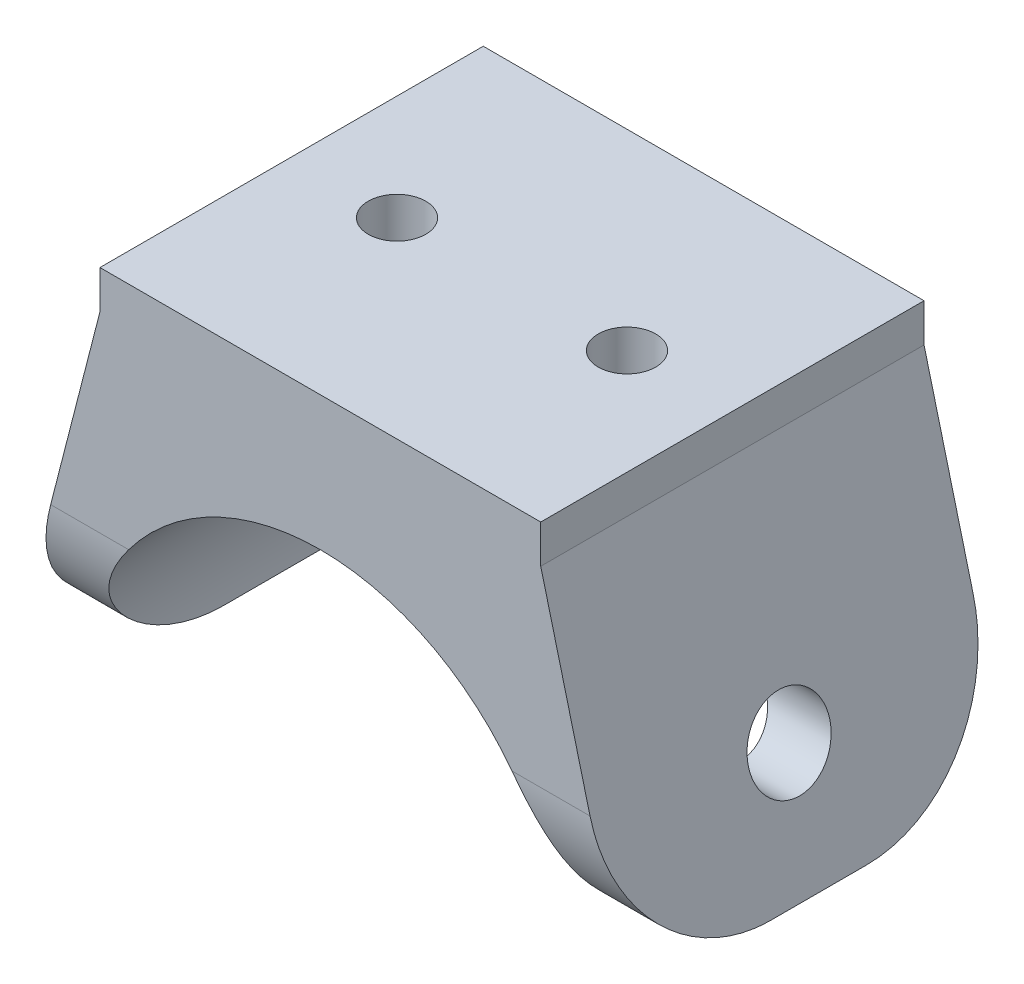
from build123d import *

# Parameters (mm, degrees)
BOSS_EXTRUDE1_DEPTH     = 20
CUT_EXTRUDE1_DEPTH      = 55.267854205
CUT_EXTRUDE1_DEPTH_BACK = 55.267854205
SKETCH3_R               = 4.25
SKETCH4_R               = 3
CUT_EXTRUDE2_DEPTH      = 14
FILLET1_R               = 15


with BuildPart() as part:
    # Sketch1 → Boss-Extrude1 (new, symmetric)
    with BuildSketch(Plane.XY):
        with BuildLine():
            Line((25, 0), (32, 0))
            Line((32, 0), (23, 35))
            Line((23, 35), (23, 39))
            Line((23, 39), (-23, 39))
            Line((-23, 39), (-23, 35))
            Line((-23, 35), (-32, 0))
            Line((-32, 0), (-25, 0))
            ThreePointArc((-25, 0), (0, 25), (25, 0))
        make_face()
    extrude(amount=BOSS_EXTRUDE1_DEPTH, both=True)

    # Sketch3 → Cut-Extrude1 (cut, two sides: drawn at the far end of the back side and taken through both)
    with BuildSketch(Plane(origin=(0, 0, 0), x_dir=(0, 0, -1), z_dir=(1, 0, 0)).offset(-CUT_EXTRUDE1_DEPTH_BACK)):
        with Locations((0, 12)):
            Circle(SKETCH3_R)
    extrude(amount=CUT_EXTRUDE1_DEPTH + CUT_EXTRUDE1_DEPTH_BACK, mode=Mode.SUBTRACT)

    # Sketch4 → Cut-Extrude2 (cut)
    with BuildSketch(Plane(origin=(0, 39, 0), x_dir=(1, 0, 0), z_dir=(0, 1, 0))):
        with Locations(Location((12, 0, 0), (0, 0, 270))):
            Circle(SKETCH4_R)
        with Locations(Location((-12, 0, 0), (0, 0, 270))):
            Circle(SKETCH4_R)
    extrude(amount=-CUT_EXTRUDE2_DEPTH, mode=Mode.SUBTRACT)

    # Fillet1
    fillet1_edges = [part.edges().sort_by_distance(p)[0] for p in [
        (28.5, 0, 20),
        (-28.5, 0, -20),
        (-28.5, 0, 20),
        (28.5, 0, -20),
    ]]
    fillet(fillet1_edges, radius=FILLET1_R)


solid = part.part
